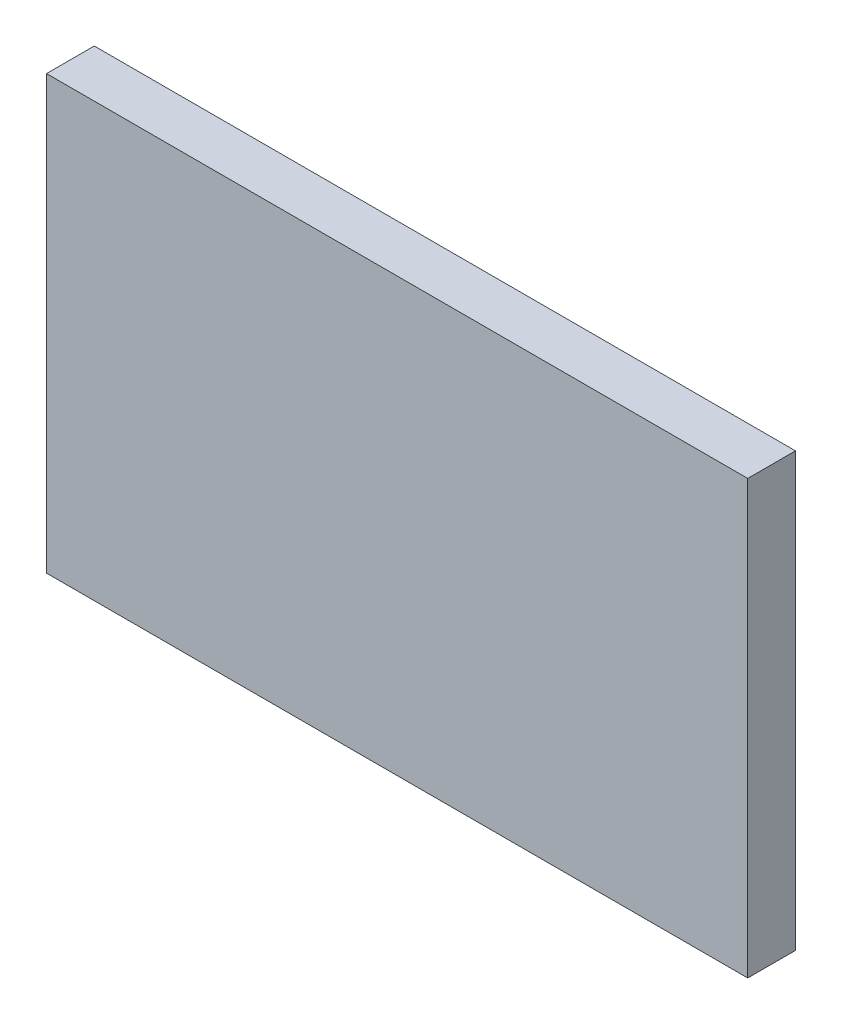
from build123d import *

# Parameters (mm, degrees)
SKETCH1_W           = 235
SKETCH1_H           = 145
BOSS_EXTRUDE1_DEPTH = 16


with BuildPart() as part:
    # Sketch1 → Boss-Extrude1 (new body)
    with BuildSketch(Plane.XY):
        Rectangle(SKETCH1_W, SKETCH1_H)
    extrude(amount=BOSS_EXTRUDE1_DEPTH)


solid = part.part
